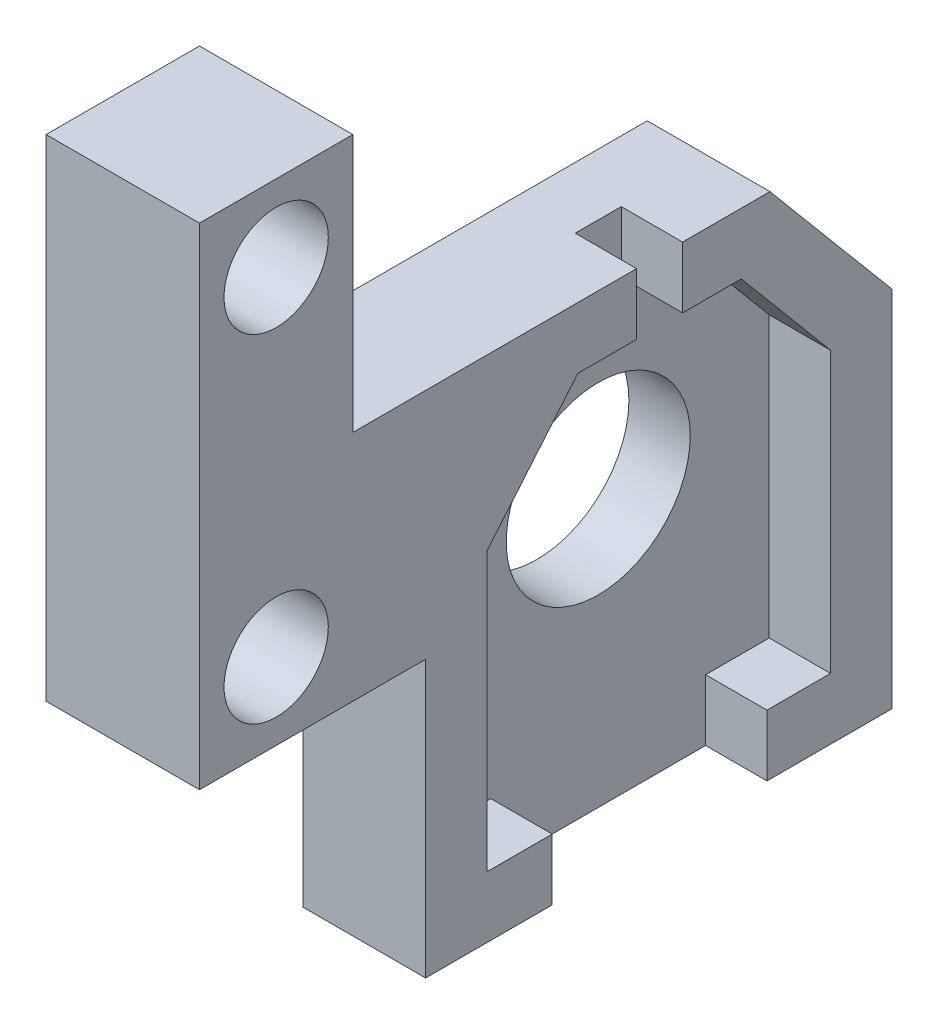
from build123d import *

# Parameters (mm, degrees)
BOSS_EXTRUDE1_DEPTH = 2
BOSS_EXTRUDE2_DEPTH = 2
SKETCH3_R           = 3
CUT_EXTRUDE1_DEPTH  = 2
SKETCH4_R           = 1.7
BOSS_EXTRUDE3_DEPTH = 5
CUT_EXTRUDE2_DEPTH  = 1


with BuildPart() as part:
    # Sketch2 → Boss-Extrude1 (new body)
    with BuildSketch(Plane(origin=(0, 0, 0), x_dir=(0, 0, -1), z_dir=(1, 0, 0))):
        Polygon((-8.109308511, -7.091340238), (-8.109308511, 4.696600231), (-4.079902129, 9.498659762), (3.11566899, 9.498659762), (7.090691489, 4.761412419), (7.090691489, -7.091340238), align=None)
    extrude(amount=-BOSS_EXTRUDE1_DEPTH)

    # Sketch1 → Boss-Extrude2 (add)
    with BuildSketch(Plane(origin=(0, 0, 0), x_dir=(0, 0, -1), z_dir=(1, 0, 0))):
        Polygon((-6.109308511, 3.968659762), (-3.147286813, 7.498659762), (-1.232116569, 7.498659762), (-1.232116569, 9.498659762), (-4.079902129, 9.498659762), (-8.109308511, 4.696600231), (-8.109308511, -7.091340238), (-3.982116569, -7.091340238), (-3.982116569, -5.091340238), (-6.109308511, -5.091340238), align=None)
        Polygon((5.090691489, 4.03347195), (5.090691489, -5.091340238), (3.017883431, -5.091340238), (3.017883431, -7.091340238), (7.090691489, -7.091340238), (7.090691489, 4.761412419), (3.11566899, 9.498659762), (0.267883431, 9.498659762), (0.267883431, 7.498659762), (2.183053674, 7.498659762), align=None)
    extrude(amount=BOSS_EXTRUDE2_DEPTH)

    # Sketch3 → Cut-Extrude1 (cut)
    with BuildSketch(Plane(origin=(0, 0, 0), x_dir=(0, 0, -1), z_dir=(1, 0, 0))):
        with Locations((-0.482116569, 1.908659762)):
            Circle(SKETCH3_R)
    extrude(amount=-CUT_EXTRUDE1_DEPTH, mode=Mode.SUBTRACT)

    # Sketch4 → Boss-Extrude3 (add)
    with BuildSketch(Plane(origin=(2, 0, 0), x_dir=(0, 0, -1), z_dir=(1, 0, 0))):
        Polygon((-15.482116569, 1.908659762), (-8.109308511, 1.908659762), (-8.109308511, 4.696600231), (-4.079902129, 9.498659762), (-10.482116569, 9.498659762), (-10.482116569, 17.908659762), (-15.482116569, 17.908659762), align=None)
        with Locations((-12.982116569, 4.408659762)):
            Circle(SKETCH4_R, mode=Mode.SUBTRACT)
        with Locations((-12.982116569, 15.408659762)):
            Circle(SKETCH4_R, mode=Mode.SUBTRACT)
    extrude(amount=-BOSS_EXTRUDE3_DEPTH)

    # Sketch5 → Cut-Extrude2 (cut)
    with BuildSketch(Plane.ZY.offset(3)):
        Polygon((10.482116569, 9.498659762), (10.482116569, 1.908659762), (8.109308511, 1.908659762), (8.109308511, 4.696600231), (4.079902129, 9.498659762), align=None)
    extrude(amount=-CUT_EXTRUDE2_DEPTH, mode=Mode.SUBTRACT)


solid = part.part
